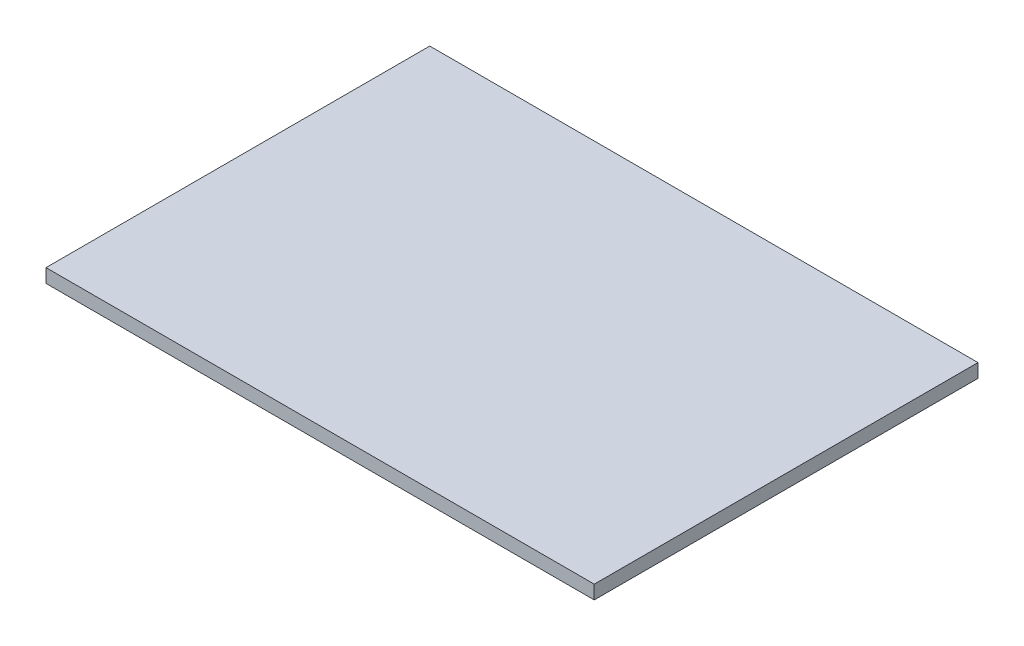
from build123d import *

# Parameters (mm, degrees)
SKETCH1_W           = 508
SKETCH1_H           = 355.6
BOSS_EXTRUDE1_DEPTH = 12.7


with BuildPart() as part:
    # Sketch1 → Boss-Extrude1 (new body)
    with BuildSketch(Plane(origin=(0, 0, 0), x_dir=(1, 0, 0), z_dir=(0, 1, 0))):
        with Locations((254, 177.8)):
            Rectangle(SKETCH1_W, SKETCH1_H)
    extrude(amount=BOSS_EXTRUDE1_DEPTH)


solid = part.part
